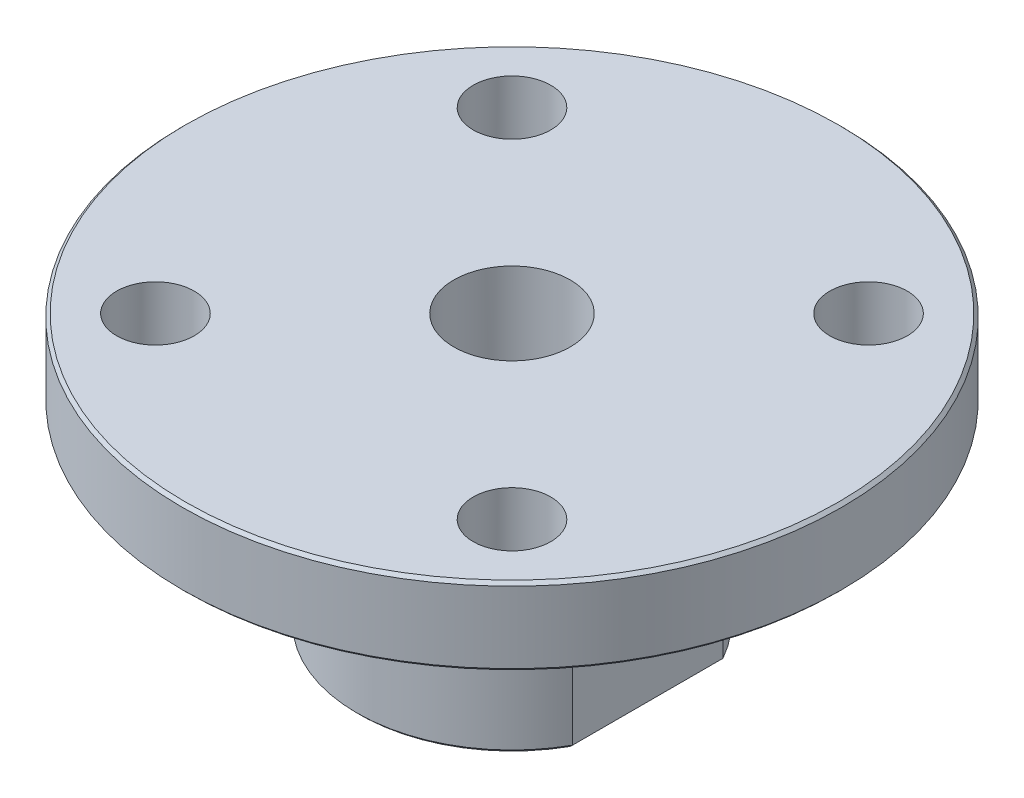
from build123d import *

# Parameters (mm, degrees)
SKETCH2_W          = 1.5875
SKETCH2_H          = 6.148361062
CUT_EXTRUDE1_DEPTH = 7.9375
SKETCH3_R          = 1.5875
CUT_EXTRUDE2_DEPTH = 23.082804042
SKETCH4_R          = 1.5875
CUT_EXTRUDE3_DEPTH = 23.082804093
CHAMFER1_SIZE      = 0.127
SCALE1_SCALE       = 0.8


with BuildPart() as part:
    # Sketch1 → Revolve1 (revolve)
    with BuildSketch(Plane.XY, mode=Mode.PRIVATE) as revolve1_sk:
        Polygon((6.35, 0), (6.35, 7.9375), (13.49375, 7.9375), (13.49375, 11.1125), (2.38125, 11.1125), (2.38125, 0), align=None)
    revolve(revolve1_sk.sketch.rotate(Axis((0, 0, 0), (0, 1, 0)), 90), axis=Axis((0, 0, 0), (0, 1, 0)))

    # Sketch2 → Cut-Extrude1 (cut)
    with BuildSketch(Plane.XZ):
        with Locations((-6.35, 0)):
            Rectangle(SKETCH2_W, SKETCH2_H)
        with Locations((6.35, 0)):
            Rectangle(SKETCH2_W, SKETCH2_H)
    extrude(amount=-CUT_EXTRUDE1_DEPTH, mode=Mode.SUBTRACT)

    # Sketch3 → Cut-Extrude2 (cut, through all)
    with BuildSketch(Plane(origin=(0, 0, 0), x_dir=(0, 0, -1), z_dir=(1, 0, 0))):
        with Locations((0, 4.7625)):
            Circle(SKETCH3_R)
    extrude(amount=-CUT_EXTRUDE2_DEPTH, mode=Mode.SUBTRACT)

    # Sketch4 → Cut-Extrude3 (cut, through all)
    with BuildSketch(Plane(origin=(0, 11.1125, 0), x_dir=(1, 0, 0), z_dir=(0, 1, 0))):
        with Locations(Location((-7.296458098, 7.296458098, 0), (0, 0, 270))):
            Circle(SKETCH4_R)
        with Locations(Location((7.296458098, 7.296458098, 0), (0, 0, 270))):
            Circle(SKETCH4_R)
        with Locations(Location((7.296458098, -7.296458098, 0), (0, 0, 270))):
            Circle(SKETCH4_R)
        with Locations(Location((-7.296458098, -7.296458098, 0), (0, 0, 270))):
            Circle(SKETCH4_R)
    extrude(amount=-CUT_EXTRUDE3_DEPTH, mode=Mode.SUBTRACT)

    # Chamfer1
    chamfer1_edges = [part.edges().sort_by_distance(p)[0] for p in [
        (0, 0, -6.35),
        (-5.55625, 0, 0),
        (0, 0, 6.35),
        (5.55625, 0, 0),
        (0, 7.9375, 13.49375),
        (0, 11.1125, 13.49375),
    ]]
    chamfer(chamfer1_edges, length=CHAMFER1_SIZE)


with BuildPart() as part_1:
    # Scale1: scaled about (0.041859241, 7.73108623, -1.62e-07)
    add(part.part.scale(SCALE1_SCALE).moved(Location((0.008371848, 1.546217246, -3.2e-08))))


solid = part_1.part
